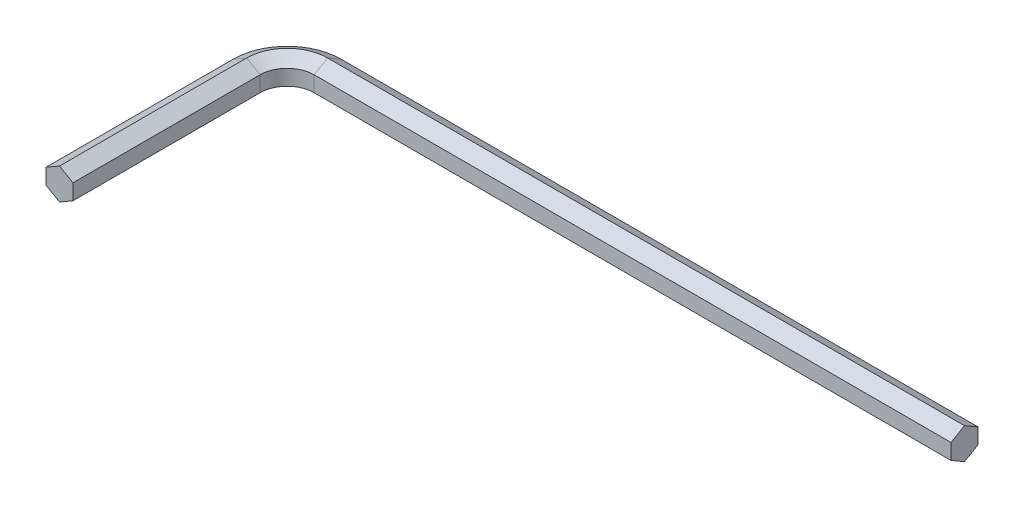
from build123d import *


with BuildPart() as part:
    # Sweep1: sweep along a path in Sketch1
    with BuildLine(Plane(origin=(0, 0, 0), x_dir=(1, 0, 0), z_dir=(0, 1, 0))) as sweep1_path:
        Line((0, 0), (-47.2125, 0))
        ThreePointArc((-47.2125, 0), (-48.626713562, -0.585786438), (-49.2125, -2))
        Line((-49.2125, -2), (-49.2125, -15.875))
    # Sketch2 → Sweep1 (sweep)
    with BuildSketch(Plane(origin=(0, 0, 0), x_dir=(0, 0, -1), z_dir=(1, 0, 0))):
        Polygon((1, -0.577350269), (2, 0), (2, 1.154700538), (1, 1.732050808), (0, 1.154700538), (0, 0), align=None)
    sweep(path=sweep1_path.line)


solid = part.part
